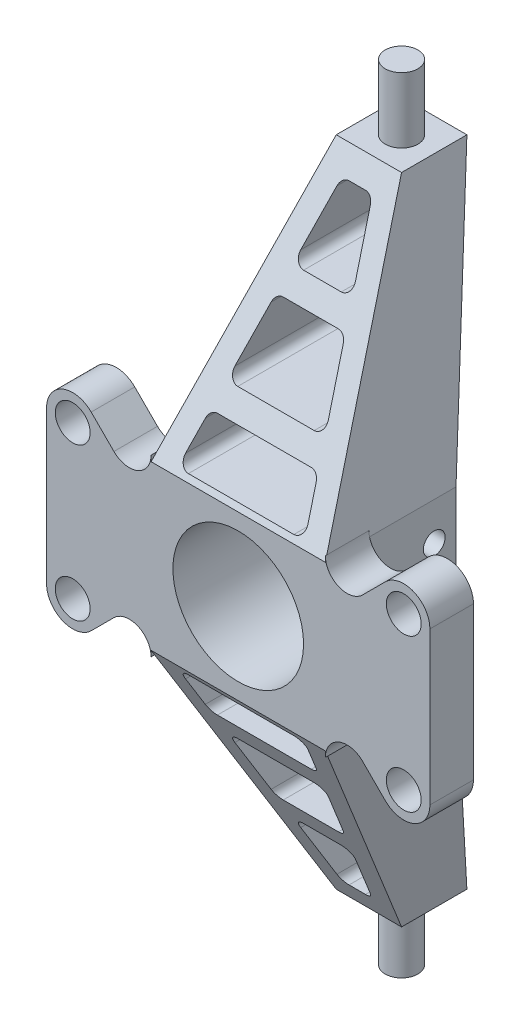
from build123d import *

# Parameters (mm, degrees)
BOSS_EXTRUDE1_DEPTH     = 20
CUT_EXTRUDE1_DEPTH      = 90.721792225
CUT_EXTRUDE1_DEPTH_BACK = 90.721792225
SKETCH2_R               = 15
SKETCH3_R               = 4
BOSS_EXTRUDE2_DEPTH     = 10
SKETCH5_R               = 3.75
BOSS_EXTRUDE3_DEPTH     = 15
CUT_EXTRUDE2_DEPTH      = 110.822584198
CUT_EXTRUDE3_DEPTH      = 105.575331699
SKETCH8_R               = 2.5
CUT_EXTRUDE4_DEPTH      = 115.437756007


with BuildPart() as part:
    # Sketch1 → Boss-Extrude1 (new, symmetric)
    with BuildSketch(Plane(origin=(0, 0, 0), x_dir=(0, 0, -1), z_dir=(1, 0, 0))):
        Polygon((-15, -18.75), (-15, 18.75), (15, 75), (30, 75), (15, 18.75), (15, -18.75), (30, -75), (15, -75), align=None)
    extrude(amount=BOSS_EXTRUDE1_DEPTH, both=True)

    # Sketch2 → Cut-Extrude1 (cut, two sides: drawn at the far end of the back side and taken through both)
    with BuildSketch(Plane.XY.offset(15).offset(-CUT_EXTRUDE1_DEPTH_BACK)):
        Circle(SKETCH2_R)
    extrude(amount=CUT_EXTRUDE1_DEPTH + CUT_EXTRUDE1_DEPTH_BACK, mode=Mode.SUBTRACT)

    # Sketch5 → Boss-Extrude3 (add)
    with BuildSketch(Plane(origin=(0, 75, 0), x_dir=(1, 0, 0), z_dir=(0, 1, 0))):
        with Locations(Location((0, 22.5, 0), (0, 0, 270))):
            Circle(SKETCH5_R)
    boss_extrude3 = extrude(amount=BOSS_EXTRUDE3_DEPTH)

    # Mirror1: Boss-Extrude3 across plane
    add(boss_extrude3.mirror(Plane.ZX))

    # Sketch6 → Cut-Extrude2 (cut, symmetric)
    with BuildSketch(Plane.XY.offset(15)):
        Polygon((20, 18.75), (20, 75), (7.5, 75), align=None)
        Polygon((-20, 75), (-20, 18.75), (-7.5, 75), align=None)
    cut_extrude2 = extrude(amount=CUT_EXTRUDE2_DEPTH, both=True, mode=Mode.SUBTRACT)

    # Mirror2: Cut-Extrude2 across plane
    add(cut_extrude2.mirror(Plane.ZX), mode=Mode.SUBTRACT)

    # Sketch7 → Cut-Extrude3 (cut, symmetric)
    with BuildSketch(Plane.XY):
        with BuildLine():
            Line((-12.107020978, 20), (12.107020978, 20))
            ThreePointArc((12.107020978, 20), (13.667104602, 20.748545213), (14.059395098, 22.433860916))
            Line((14.059395098, 22.433860916), (12.726061765, 28.433860916))
            ThreePointArc((12.726061765, 28.433860916), (12.025142432, 29.560083625), (10.773687644, 30))
            Line((10.773687644, 30), (-10.773687644, 30))
            ThreePointArc((-10.773687644, 30), (-12.025142432, 29.560083625), (-12.726061765, 28.433860916))
            Line((-12.726061765, 28.433860916), (-14.059395098, 22.433860916))
            ThreePointArc((-14.059395098, 22.433860916), (-13.667104602, 20.748545213), (-12.107020978, 20))
        make_face()
        with BuildLine():
            Line((1.884798755, 70), (-1.884798755, 70))
            ThreePointArc((-1.884798755, 70), (-3.136253543, 69.560083625), (-3.837172876, 68.433860916))
            Line((-3.837172876, 68.433860916), (-6.28161732, 57.433860916))
            ThreePointArc((-6.28161732, 57.433860916), (-5.889326824, 55.748545213), (-4.3292432, 55))
            Line((-4.3292432, 55), (4.3292432, 55))
            ThreePointArc((4.3292432, 55), (5.889326824, 55.748545213), (6.28161732, 57.433860916))
            Line((6.28161732, 57.433860916), (3.837172876, 68.433860916))
            ThreePointArc((3.837172876, 68.433860916), (3.136253543, 69.560083625), (1.884798755, 70))
        make_face()
        with BuildLine():
            Line((-8.773687644, 35), (8.773687644, 35))
            ThreePointArc((8.773687644, 35), (10.333771269, 35.748545213), (10.726061765, 37.433860916))
            Line((10.726061765, 37.433860916), (8.28161732, 48.433860916))
            ThreePointArc((8.28161732, 48.433860916), (7.580697987, 49.560083625), (6.3292432, 50))
            Line((6.3292432, 50), (-6.3292432, 50))
            ThreePointArc((-6.3292432, 50), (-7.580697987, 49.560083625), (-8.28161732, 48.433860916))
            Line((-8.28161732, 48.433860916), (-10.726061765, 37.433860916))
            ThreePointArc((-10.726061765, 37.433860916), (-10.333771269, 35.748545213), (-8.773687644, 35))
        make_face()
    cut_extrude3 = extrude(amount=CUT_EXTRUDE3_DEPTH, both=True, mode=Mode.SUBTRACT)

    # Mirror3: Cut-Extrude3 across plane
    add(cut_extrude3.mirror(Plane.ZX), mode=Mode.SUBTRACT)


with BuildPart() as body_2:
    # Sketch3 → Boss-Extrude2 (new body)
    with BuildSketch(Plane.XY.offset(15)):
        with BuildLine():
            ThreePointArc((-20, 20.056349186), (-23.086582838, 15.436951524), (-28.535533906, 16.52081528))
            Line((-28.535533906, 16.52081528), (-33.757359313, 21.742640687))
            ThreePointArc((-33.757359313, 21.742640687), (-40.296100594, 23.043277195), (-44, 17.5))
            Line((-44, 17.5), (-44, -17.5))
            ThreePointArc((-44, -17.5), (-40.296100594, -23.043277195), (-33.757359313, -21.742640687))
            Line((-33.757359313, -21.742640687), (-28.535533906, -16.52081528))
            ThreePointArc((-28.535533906, -16.52081528), (-23.086582838, -15.436951524), (-20, -20.056349186))
            Line((-20, -20.056349186), (-20, -18.75))
            Line((-20, -18.75), (-20, 18.75))
            Line((-20, 18.75), (-20, 20.056349186))
        make_face()
        with Locations((-38, -17.5)):
            Circle(SKETCH3_R, mode=Mode.SUBTRACT)
        with Locations((-38, 17.5)):
            Circle(SKETCH3_R, mode=Mode.SUBTRACT)
    boss_extrude2 = extrude(amount=-BOSS_EXTRUDE2_DEPTH)


with BuildPart() as part_1:
    add(part.part)

    # Mirror6: Boss-Extrude2 across plane
    add(boss_extrude2.mirror(Plane(origin=(0, 0, 0), x_dir=(0, 0, 1), z_dir=(1, 0, 0))))

    # Combine1: union body 2
    add(body_2.part)

    # Sketch8 → Cut-Extrude4 (cut, through all)
    with BuildSketch(Plane(origin=(20, 0, 0), x_dir=(0, 0, -1), z_dir=(1, 0, 0))):
        with Locations((10, 10)):
            Circle(SKETCH8_R)
        with Locations((10, -10)):
            Circle(SKETCH8_R)
    extrude(amount=-CUT_EXTRUDE4_DEPTH, mode=Mode.SUBTRACT)


solid = part_1.part
